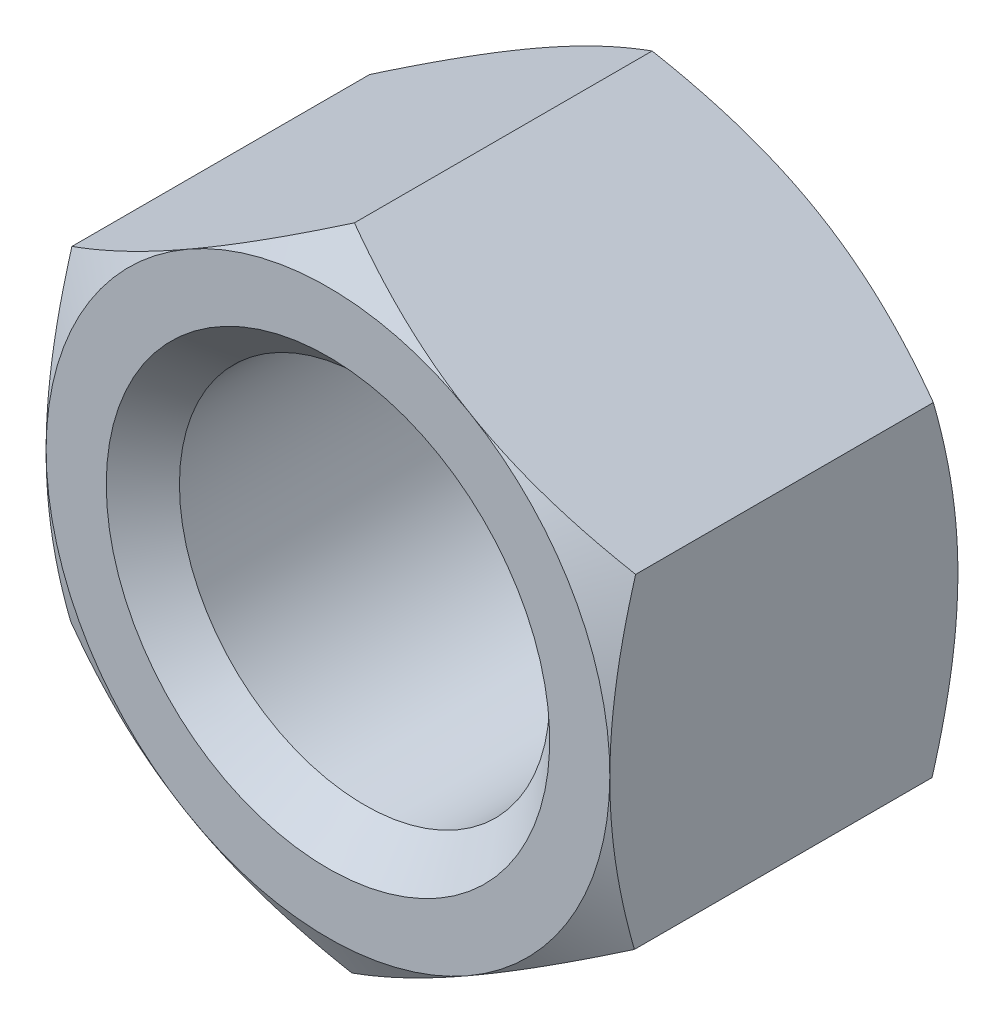
from build123d import *

# Parameters (mm, degrees)
SKETCH_1_R          = 2.5
EXTRUDE_658_DEPTH   = 4.7
SKETCH_2_OUTSIDE_W  = 41.518
SKETCH_2_OUTSIDE_H  = 42.678
SKETCH_2_OUTSIDE_R  = 3.80618165
CUT_EXTRUDE_1_DEPTH = 8.480534567
CUT_EXTRUDE_1_DRAFT = -60
SKETCH_3_OUTSIDE_W  = 41.518
SKETCH_3_OUTSIDE_H  = 42.678
SKETCH_3_OUTSIDE_R  = 3.80618165
CUT_EXTRUDE_2_DEPTH = 8.480534567
CUT_EXTRUDE_2_DRAFT = -60
CHAMFER_1_SIZE      = 0.494047619


with BuildPart() as part:
    # 草图1 → Extrude 658 (new body)
    with BuildSketch(Plane.XY):
        Polygon((0.017288321, 4.394965997), (-3.797508041, 2.212455124), (-3.814796363, -2.182510873), (-0.017288321, -4.394965997), (3.797508041, -2.212455124), (3.814796363, 2.182510873), align=None)
        Circle(SKETCH_1_R, mode=Mode.SUBTRACT)
    extrude(amount=EXTRUDE_658_DEPTH)


with BuildPart() as cut_extrude_1_tool:
    # 草图2 outside → 切除-拉伸1 (with draft: the straight prism first)
    with BuildSketch(Plane(origin=(0, 0, 0), x_dir=(-1, 0, 0), z_dir=(0, 0, -1))):
        Rectangle(SKETCH_2_OUTSIDE_W, SKETCH_2_OUTSIDE_H)
        Circle(SKETCH_2_OUTSIDE_R, mode=Mode.SUBTRACT)
    extrude(amount=-CUT_EXTRUDE_1_DEPTH)
    # 切除-拉伸1: the draft: its side faces are tilted about the plane it starts from
    cut_extrude_1_sides = [cut_extrude_1_tool.faces().sort_by_distance(p)[0] for p in [
        (0, -21.339, 4.240267283),
        (-20.759, 0, 4.240267283),
        (0, 21.339, 4.240267283),
        (20.759, 0, 4.240267283),
        (3.80618165, 0, 4.240267283),
    ]]
    draft(cut_extrude_1_sides, Plane(origin=(0, 0, 0), x_dir=(-1, 0, 0), z_dir=(0, 0, -1)), CUT_EXTRUDE_1_DRAFT)


with BuildPart() as part_1:
    add(part.part)

    # 切除-拉伸1: cut by cut_extrude_1_tool
    add(cut_extrude_1_tool.part, mode=Mode.SUBTRACT)


with BuildPart() as cut_extrude_2_tool:
    # 草图3 outside → 切除-拉伸2 (with draft: the straight prism first)
    with BuildSketch(Plane.XY.offset(4.7)):
        Rectangle(SKETCH_3_OUTSIDE_W, SKETCH_3_OUTSIDE_H)
        Circle(SKETCH_3_OUTSIDE_R, mode=Mode.SUBTRACT)
    extrude(amount=-CUT_EXTRUDE_2_DEPTH)
    # 切除-拉伸2: the draft: its side faces are tilted about the plane it starts from
    cut_extrude_2_sides = [cut_extrude_2_tool.faces().sort_by_distance(p)[0] for p in [
        (0, -21.339, 0.459732717),
        (20.759, 0, 0.459732717),
        (0, 21.339, 0.459732717),
        (-20.759, 0, 0.459732717),
        (-3.80618165, 0, 0.459732717),
    ]]
    draft(cut_extrude_2_sides, Plane.XY.offset(4.7), CUT_EXTRUDE_2_DRAFT)


with BuildPart() as part_2:
    add(part_1.part)

    # 切除-拉伸2: cut by cut_extrude_2_tool
    add(cut_extrude_2_tool.part, mode=Mode.SUBTRACT)

    # 倒角1
    chamfer_1_edges = [part_2.edges().sort_by_distance(p)[0] for p in [
        (-2.5, 0, 0),
        (-2.5, 0, 4.7),
    ]]
    chamfer(chamfer_1_edges, length=CHAMFER_1_SIZE)


solid = part_2.part
